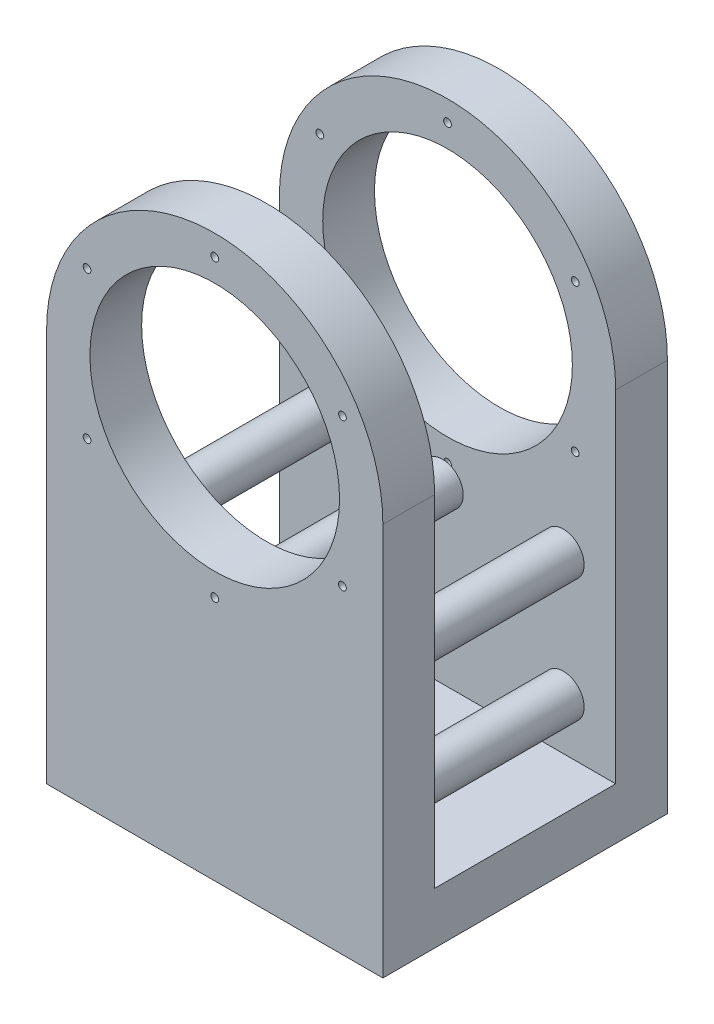
from build123d import *

# Parameters (mm, degrees)
SKETCH_1_R                      = 48.25
EXTRUDE_1_DEPTH                 = 20
SKETCH_2_R                      = 8
EXTRUDE_2_DEPTH                 = 70
EXTRUDE_START                   = 20
SKETCH_3_R                      = 48.25
EXTRUDE_3_DEPTH                 = 20
SKETCH_4_R                      = 48.25
SKETCH_4_R_2                    = 8
CUT_EXTRUDE_2_DEPTH             = 226.004920864
SKETCH_5_W                      = 130
SKETCH_5_H                      = 20
EXTRUDE_4_DEPTH                 = 70
SKETCH_6_R                      = 30
CUT_EXTRUDE_3_DEPTH             = 20
SKETCH_7_R                      = 30
EXTRUDE_5_DEPTH                 = 20
SKETCH_8_R                      = 1.65
EXTRUDE_7_DEPTH                 = 10
CUT_EXTRUDE_4_REACH             = 245.63
SKETCH_9_R                      = 1.65
CUT_EXTRUDE_4_DIRECTION_2_REACH = 245.63
SKETCH_10_R                     = 1.5
CUT_EXTRUDE_5_DEPTH             = 216.933356416
SKETCH_11_R                     = 1.5
CUT_EXTRUDE_6_DEPTH             = 216.933356416


with BuildPart() as part:
    # 草图1 → 凸台-拉伸1 (new body)
    with BuildSketch(Plane.XY):
        with BuildLine():
            Line((-65, -103.52590801), (-65, 120.208570031))
            ThreePointArc((-65, 120.208570031), (0, 185.208570031), (65, 120.208570031))
            Line((65, 120.208570031), (65, -103.52590801))
            ThreePointArc((65, -103.52590801), (0, -168.52590801), (-65, -103.52590801))
        make_face()
        with Locations((0, 120.208570031)):
            Circle(SKETCH_1_R, mode=Mode.SUBTRACT)
        with Locations(Location((0, -103.52590801, 0), (0, 0, 180))):
            Circle(SKETCH_1_R, mode=Mode.SUBTRACT)
    extrude(amount=EXTRUDE_1_DEPTH)

    # 草图2 → 凸台-拉伸2 (add)
    with BuildSketch(Plane(origin=(0, 0, 0), x_dir=(-1, 0, 0), z_dir=(0, 0, -1))):
        with Locations(Location((-44.812568829, 55.531490167, 0), (0, 0, 180))):
            Circle(SKETCH_2_R)
        with Locations(Location((-44.812568829, -39.65707978, 0), (0, 0, 180))):
            Circle(SKETCH_2_R)
        with Locations(Location((48.660082913, -39.65707978, 0), (0, 0, 180))):
            Circle(SKETCH_2_R)
        with Locations(Location((48.660082913, 55.531490167, 0), (0, 0, 180))):
            Circle(SKETCH_2_R)
        with Locations(Location((1.923757042, 55.531490167, 0), (0, 0, 180))):
            Circle(SKETCH_2_R)
        with Locations(Location((1.923757042, -39.65707978, 0), (0, 0, 180))):
            Circle(SKETCH_2_R)
        with Locations(Location((-44.812568829, 7.937205194, 0), (0, 0, 180))):
            Circle(SKETCH_2_R)
        with Locations(Location((48.660082913, 7.937205194, 0), (0, 0, 180))):
            Circle(SKETCH_2_R)
    extrude(amount=EXTRUDE_2_DEPTH)

    # 草图3 → 凸台-拉伸3 (add)
    with BuildSketch(Plane(origin=(0, 0, -70), x_dir=(-1, 0, 0), z_dir=(0, 0, -1)).offset(EXTRUDE_START)):
        with BuildLine():
            Line((65, -103.52590801), (65, 120.208570031))
            ThreePointArc((65, 120.208570031), (0, 185.208570031), (-65, 120.208570031))
            Line((-65, 120.208570031), (-65, -103.52590801))
            ThreePointArc((-65, -103.52590801), (0, -168.52590801), (65, -103.52590801))
        make_face()
        with Locations(Location((0, 120.208570031, 0), (0, 0, 180))):
            Circle(SKETCH_3_R, mode=Mode.SUBTRACT)
        with Locations((0, -103.52590801)):
            Circle(SKETCH_3_R, mode=Mode.SUBTRACT)
    extrude(amount=-EXTRUDE_3_DEPTH)

    # 草图4 → 切除-拉伸2 (cut, through all)
    # profile 1 of 5: a face of its own
    with BuildSketch(Plane.XY.offset(20)):
        with BuildLine():
            Line((-48.660082913, -31.65707978), (-65, -31.65707978))
            Line((-65, -31.65707978), (-65, -103.52590801))
            ThreePointArc((-65, -103.52590801), (0, -168.52590801), (65, -103.52590801))
            Line((65, -103.52590801), (65, -31.65707978))
            Line((65, -31.65707978), (44.812568829, -31.65707978))
            Line((44.812568829, -31.65707978), (-1.923757018, -31.65707978))
            Line((-1.923757018, -31.65707978), (-48.660082913, -31.65707978))
        make_face()
        with BuildLine():
            ThreePointArc((-40.660082913, -39.65707978), (-54.316937162, -45.313934029), (-48.660082913, -31.65707978))
            ThreePointArc((-48.660082913, -31.65707978), (-43.003228663, -34.000225531), (-40.660082913, -39.65707978))
        make_face(mode=Mode.SUBTRACT)
        with BuildLine():
            ThreePointArc((6.076242958, -39.65707978), (-7.5806113, -45.313934021), (-1.923757018, -31.65707978))
            ThreePointArc((-1.923757018, -31.65707978), (3.733097216, -34.000225539), (6.076242958, -39.65707978))
        make_face(mode=Mode.SUBTRACT)
        with Locations((0, -103.52590801)):
            Circle(SKETCH_4_R, mode=Mode.SUBTRACT)
        with BuildLine():
            ThreePointArc((52.812568829, -39.65707978), (39.155714579, -45.313934029), (44.812568829, -31.65707978))
            ThreePointArc((44.812568829, -31.65707978), (50.469423078, -34.000225531), (52.812568829, -39.65707978))
        make_face(mode=Mode.SUBTRACT)
    # profile 2 of 5: a face of its own
    with BuildSketch(Plane.XY.offset(20)):
        with Locations((0, -103.52590801)):
            Circle(SKETCH_4_R)
    # profile 3 of 5: a face of its own
    with BuildSketch(Plane.XY.offset(20)):
        with Locations((-1.923757042, -39.65707978)):
            Circle(SKETCH_4_R_2)
    # profile 4 of 5: a face of its own
    with BuildSketch(Plane.XY.offset(20)):
        with Locations((44.812568829, -39.65707978)):
            Circle(SKETCH_4_R_2)
    # profile 5 of 5: a face of its own
    with BuildSketch(Plane.XY.offset(20)):
        with Locations((-48.660082913, -39.65707978)):
            Circle(SKETCH_4_R_2)
    extrude(amount=-CUT_EXTRUDE_2_DEPTH, mode=Mode.SUBTRACT)

    # 草图5 → 凸台-拉伸4 (add)
    with BuildSketch(Plane(origin=(0, 0, 0), x_dir=(-1, 0, 0), z_dir=(0, 0, -1))):
        with Locations((0, -21.65707978)):
            Rectangle(SKETCH_5_W, SKETCH_5_H)
    extrude(amount=EXTRUDE_4_DEPTH)

    # 草图6 → 切除-拉伸3 (cut)
    with BuildSketch(Plane.XZ.offset(31.65707978)):
        with Locations((0, -35)):
            Circle(SKETCH_6_R)
    extrude(amount=-CUT_EXTRUDE_3_DEPTH, mode=Mode.SUBTRACT)

    # 草图7 → 凸台-拉伸5 (add)
    with BuildSketch(Plane.XZ.offset(31.65707978)):
        with Locations((0, -35)):
            Circle(SKETCH_7_R)
    extrude(amount=-EXTRUDE_5_DEPTH)

    # 草图8 → 凸台-拉伸7 (add)
    with BuildSketch(Plane.XZ.offset(31.65707978)):
        with Locations((0, -17.75)):
            Circle(SKETCH_8_R)
        with Locations((14.938938215, -26.375)):
            Circle(SKETCH_8_R)
        with Locations((14.938938215, -43.625)):
            Circle(SKETCH_8_R)
        with Locations((0, -52.25)):
            Circle(SKETCH_8_R)
        with Locations((-14.938938215, -43.625)):
            Circle(SKETCH_8_R)
        with Locations((-14.938938215, -26.375)):
            Circle(SKETCH_8_R)
    extrude(amount=EXTRUDE_7_DEPTH)

    # 草图9 → 切除-拉伸4 (cut, up to next)
    with BuildSketch(Plane.XZ.offset(31.65707978), mode=Mode.PRIVATE) as cut_extrude_4_sk1:
        with Locations(Location((0, -52.25, 0), (0, 0, 90))):
            Circle(SKETCH_9_R)
    cut_extrude_4_tool1 = extrude(cut_extrude_4_sk1.sketch, amount=-CUT_EXTRUDE_4_REACH, mode=Mode.PRIVATE) & part.part
    # 草图9 → 切除-拉伸4 (cut, up to next)
    with BuildSketch(Plane.XZ.offset(31.65707978), mode=Mode.PRIVATE) as cut_extrude_4_sk2:
        with Locations(Location((14.938938215, -43.625, 0), (0, 0, 90))):
            Circle(SKETCH_9_R)
    cut_extrude_4_tool2 = extrude(cut_extrude_4_sk2.sketch, amount=-CUT_EXTRUDE_4_REACH, mode=Mode.PRIVATE) & part.part
    # 草图9 → 切除-拉伸4 (cut, up to next)
    with BuildSketch(Plane.XZ.offset(31.65707978), mode=Mode.PRIVATE) as cut_extrude_4_sk3:
        with Locations(Location((14.938938215, -26.375, 0), (0, 0, 90))):
            Circle(SKETCH_9_R)
    cut_extrude_4_tool3 = extrude(cut_extrude_4_sk3.sketch, amount=-CUT_EXTRUDE_4_REACH, mode=Mode.PRIVATE) & part.part
    # 草图9 → 切除-拉伸4 (cut, up to next)
    with BuildSketch(Plane.XZ.offset(31.65707978), mode=Mode.PRIVATE) as cut_extrude_4_sk4:
        with Locations(Location((-14.938938215, -43.625, 0), (0, 0, 90))):
            Circle(SKETCH_9_R)
    cut_extrude_4_tool4 = extrude(cut_extrude_4_sk4.sketch, amount=-CUT_EXTRUDE_4_REACH, mode=Mode.PRIVATE) & part.part
    # 草图9 → 切除-拉伸4 (cut, up to next)
    with BuildSketch(Plane.XZ.offset(31.65707978), mode=Mode.PRIVATE) as cut_extrude_4_sk5:
        with Locations(Location((-14.938938215, -26.375, 0), (0, 0, 90))):
            Circle(SKETCH_9_R)
    cut_extrude_4_tool5 = extrude(cut_extrude_4_sk5.sketch, amount=-CUT_EXTRUDE_4_REACH, mode=Mode.PRIVATE) & part.part
    # 草图9 → 切除-拉伸4 (cut, up to next)
    with BuildSketch(Plane.XZ.offset(31.65707978), mode=Mode.PRIVATE) as cut_extrude_4_sk6:
        with Locations(Location((0, -17.75, 0), (0, 0, 90))):
            Circle(SKETCH_9_R)
    cut_extrude_4_tool6 = extrude(cut_extrude_4_sk6.sketch, amount=-CUT_EXTRUDE_4_REACH, mode=Mode.PRIVATE) & part.part
    add(cut_extrude_4_tool1.solids().sort_by_distance((0, -31.65708, -52.25))[0], mode=Mode.SUBTRACT)
    add(cut_extrude_4_tool2.solids().sort_by_distance((14.938938, -31.65708, -43.625))[0], mode=Mode.SUBTRACT)
    add(cut_extrude_4_tool3.solids().sort_by_distance((14.938938, -31.65708, -26.375))[0], mode=Mode.SUBTRACT)
    add(cut_extrude_4_tool4.solids().sort_by_distance((-14.938938, -31.65708, -43.625))[0], mode=Mode.SUBTRACT)
    add(cut_extrude_4_tool5.solids().sort_by_distance((-14.938938, -31.65708, -26.375))[0], mode=Mode.SUBTRACT)
    add(cut_extrude_4_tool6.solids().sort_by_distance((0, -31.65708, -17.75))[0], mode=Mode.SUBTRACT)

    # 草图9 → 切除-拉伸4 direction 2 (cut, up to next)
    with BuildSketch(Plane.XZ.offset(31.65707978), mode=Mode.PRIVATE) as cut_extrude_4_direction_2_sk1:
        with Locations(Location((0, -52.25, 0), (0, 0, 90))):
            Circle(SKETCH_9_R)
    cut_extrude_4_direction_2_tool1 = extrude(cut_extrude_4_direction_2_sk1.sketch, amount=CUT_EXTRUDE_4_DIRECTION_2_REACH, mode=Mode.PRIVATE) & part.part
    # 草图9 → 切除-拉伸4 direction 2 (cut, up to next)
    with BuildSketch(Plane.XZ.offset(31.65707978), mode=Mode.PRIVATE) as cut_extrude_4_direction_2_sk2:
        with Locations(Location((14.938938215, -43.625, 0), (0, 0, 90))):
            Circle(SKETCH_9_R)
    cut_extrude_4_direction_2_tool2 = extrude(cut_extrude_4_direction_2_sk2.sketch, amount=CUT_EXTRUDE_4_DIRECTION_2_REACH, mode=Mode.PRIVATE) & part.part
    # 草图9 → 切除-拉伸4 direction 2 (cut, up to next)
    with BuildSketch(Plane.XZ.offset(31.65707978), mode=Mode.PRIVATE) as cut_extrude_4_direction_2_sk3:
        with Locations(Location((14.938938215, -26.375, 0), (0, 0, 90))):
            Circle(SKETCH_9_R)
    cut_extrude_4_direction_2_tool3 = extrude(cut_extrude_4_direction_2_sk3.sketch, amount=CUT_EXTRUDE_4_DIRECTION_2_REACH, mode=Mode.PRIVATE) & part.part
    # 草图9 → 切除-拉伸4 direction 2 (cut, up to next)
    with BuildSketch(Plane.XZ.offset(31.65707978), mode=Mode.PRIVATE) as cut_extrude_4_direction_2_sk4:
        with Locations(Location((-14.938938215, -43.625, 0), (0, 0, 90))):
            Circle(SKETCH_9_R)
    cut_extrude_4_direction_2_tool4 = extrude(cut_extrude_4_direction_2_sk4.sketch, amount=CUT_EXTRUDE_4_DIRECTION_2_REACH, mode=Mode.PRIVATE) & part.part
    # 草图9 → 切除-拉伸4 direction 2 (cut, up to next)
    with BuildSketch(Plane.XZ.offset(31.65707978), mode=Mode.PRIVATE) as cut_extrude_4_direction_2_sk5:
        with Locations(Location((-14.938938215, -26.375, 0), (0, 0, 90))):
            Circle(SKETCH_9_R)
    cut_extrude_4_direction_2_tool5 = extrude(cut_extrude_4_direction_2_sk5.sketch, amount=CUT_EXTRUDE_4_DIRECTION_2_REACH, mode=Mode.PRIVATE) & part.part
    # 草图9 → 切除-拉伸4 direction 2 (cut, up to next)
    with BuildSketch(Plane.XZ.offset(31.65707978), mode=Mode.PRIVATE) as cut_extrude_4_direction_2_sk6:
        with Locations(Location((0, -17.75, 0), (0, 0, 90))):
            Circle(SKETCH_9_R)
    cut_extrude_4_direction_2_tool6 = extrude(cut_extrude_4_direction_2_sk6.sketch, amount=CUT_EXTRUDE_4_DIRECTION_2_REACH, mode=Mode.PRIVATE) & part.part
    add(cut_extrude_4_direction_2_tool1.solids().sort_by_distance((0, -31.65708, -52.25))[0], mode=Mode.SUBTRACT)
    add(cut_extrude_4_direction_2_tool2.solids().sort_by_distance((14.938938, -31.65708, -43.625))[0], mode=Mode.SUBTRACT)
    add(cut_extrude_4_direction_2_tool3.solids().sort_by_distance((14.938938, -31.65708, -26.375))[0], mode=Mode.SUBTRACT)
    add(cut_extrude_4_direction_2_tool4.solids().sort_by_distance((-14.938938, -31.65708, -43.625))[0], mode=Mode.SUBTRACT)
    add(cut_extrude_4_direction_2_tool5.solids().sort_by_distance((-14.938938, -31.65708, -26.375))[0], mode=Mode.SUBTRACT)
    add(cut_extrude_4_direction_2_tool6.solids().sort_by_distance((0, -31.65708, -17.75))[0], mode=Mode.SUBTRACT)

    # 草图10 → 切除-拉伸5 (cut, through all)
    with BuildSketch(Plane(origin=(0, 0, 0), x_dir=(-1, 0, 0), z_dir=(0, 0, -1))):
        with Locations((0, 177.208570031)):
            Circle(SKETCH_10_R)
        with Locations((49.363448016, 148.708570031)):
            Circle(SKETCH_10_R)
        with Locations((49.363448016, 91.708570031)):
            Circle(SKETCH_10_R)
        with Locations((0, 63.208570031)):
            Circle(SKETCH_10_R)
        with Locations((-49.363448016, 91.708570031)):
            Circle(SKETCH_10_R)
        with Locations((-49.363448016, 148.708570031)):
            Circle(SKETCH_10_R)
    extrude(amount=-CUT_EXTRUDE_5_DEPTH, mode=Mode.SUBTRACT)

    # 草图11 → 切除-拉伸6 (cut, through all)
    with BuildSketch(Plane.XY.offset(-70)):
        with Locations(Location((49.363448016, 148.708570031, 0), (0, 0, 180))):
            Circle(SKETCH_11_R)
        with Locations(Location((0, 177.208570031, 0), (0, 0, 180))):
            Circle(SKETCH_11_R)
        with Locations(Location((-49.363448016, 148.708570031, 0), (0, 0, 180))):
            Circle(SKETCH_11_R)
        with Locations(Location((0, 63.208570031, 0), (0, 0, 180))):
            Circle(SKETCH_11_R)
        with Locations(Location((-49.363448016, 91.708570031, 0), (0, 0, 180))):
            Circle(SKETCH_11_R)
        with Locations(Location((49.363448016, 91.708570031, 0), (0, 0, 180))):
            Circle(SKETCH_11_R)
    extrude(amount=-CUT_EXTRUDE_6_DEPTH, mode=Mode.SUBTRACT)


solid = part.part
